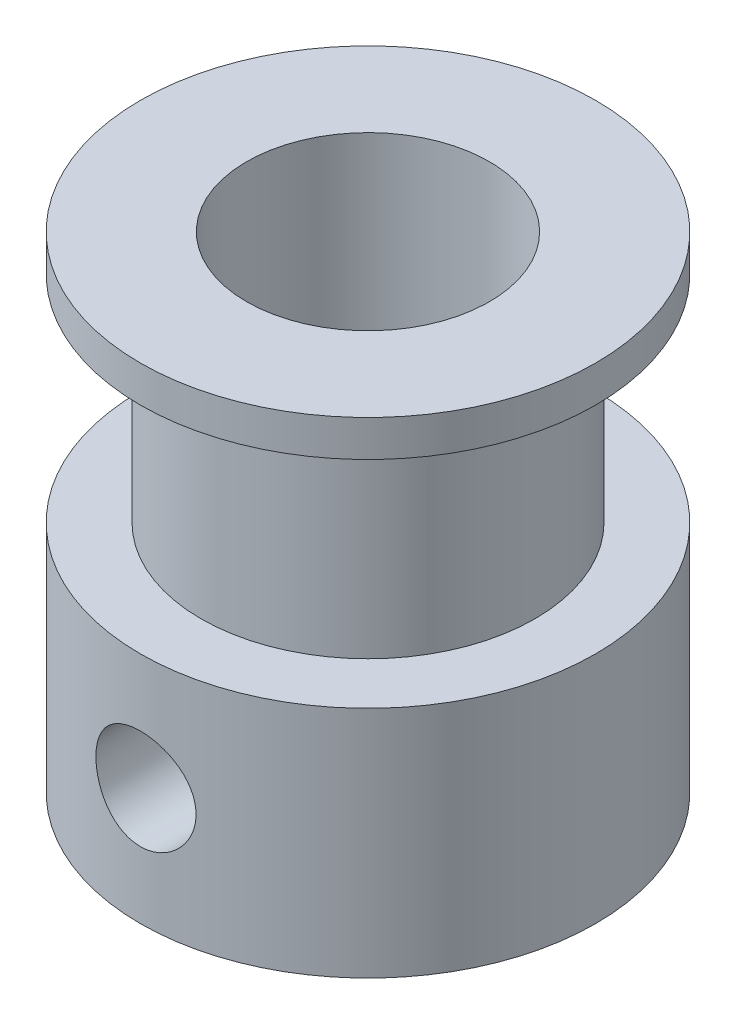
from build123d import *

# Parameters (mm, degrees)
CROQUIS1_R              = 7.5
SALIENTE_EXTRUIR1_DEPTH = 7.7
CROQUIS2_R              = 5.5
SALIENTE_EXTRUIR2_DEPTH = 7.1
CROQUIS3_R              = 7.5
SALIENTE_EXTRUIR3_DEPTH = 1.2
CROQUIS4_R              = 4
CORTAR_EXTRUIR1_DEPTH   = 20.19635382
CROQUIS5_W              = 1.65
CROQUIS5_H              = 7.501
MATRIZC1_COUNT          = 2
MATRIZC1_ANGLE          = 90


with BuildPart() as part:
    # Croquis1 → Saliente-Extruir1 (new body)
    with BuildSketch(Plane(origin=(0, 0, 0), x_dir=(1, 0, 0), z_dir=(0, 1, 0))):
        with Locations(Location((0, 0, 0), (0, 0, 90))):
            Circle(CROQUIS1_R)
    extrude(amount=SALIENTE_EXTRUIR1_DEPTH)

    # Croquis2 → Saliente-Extruir2 (add)
    with BuildSketch(Plane(origin=(0, 7.7, 0), x_dir=(1, 0, 0), z_dir=(0, 1, 0))):
        with Locations(Location((0, 0, 0), (0, 0, 270))):
            Circle(CROQUIS2_R)
    extrude(amount=SALIENTE_EXTRUIR2_DEPTH)

    # Croquis3 → Saliente-Extruir3 (add)
    with BuildSketch(Plane(origin=(0, 14.8, 0), x_dir=(1, 0, 0), z_dir=(0, 1, 0))):
        with Locations(Location((0, 0, 0), (0, 0, 90))):
            Circle(CROQUIS3_R)
    extrude(amount=SALIENTE_EXTRUIR3_DEPTH)

    # Croquis4 → Cortar-Extruir1 (cut, through all)
    with BuildSketch(Plane(origin=(0, 16, 0), x_dir=(1, 0, 0), z_dir=(0, 1, 0))):
        with Locations(Location((0, 0, 0), (0, 0, 270))):
            Circle(CROQUIS4_R)
    extrude(amount=-CORTAR_EXTRUIR1_DEPTH, mode=Mode.SUBTRACT)

    # Croquis5 → Taladro roscado M31 (definir posicio) (revolve, cut)
    with BuildSketch(Plane(origin=(0, 3.85, 0), x_dir=(0, 1, 0), z_dir=(1, 0, 0))):
        with Locations((0.825, 3.7505)):
            Rectangle(CROQUIS5_W, CROQUIS5_H)
    taladro_roscado_m31_definir_posicio = revolve(axis=Axis((0, 3.85, -6.35), (0, 0, 1)), mode=Mode.SUBTRACT)

    # MatrizC1: Taladro roscado M31 (definir posicio) ×2 about axis
    matrizc1_axis = Axis((0, 7.7, 0), (0, -1, 0))
    for i in range(1, MATRIZC1_COUNT):
        add(taladro_roscado_m31_definir_posicio.rotate(matrizc1_axis, i * MATRIZC1_ANGLE / (MATRIZC1_COUNT - 1)), mode=Mode.SUBTRACT)


solid = part.part
